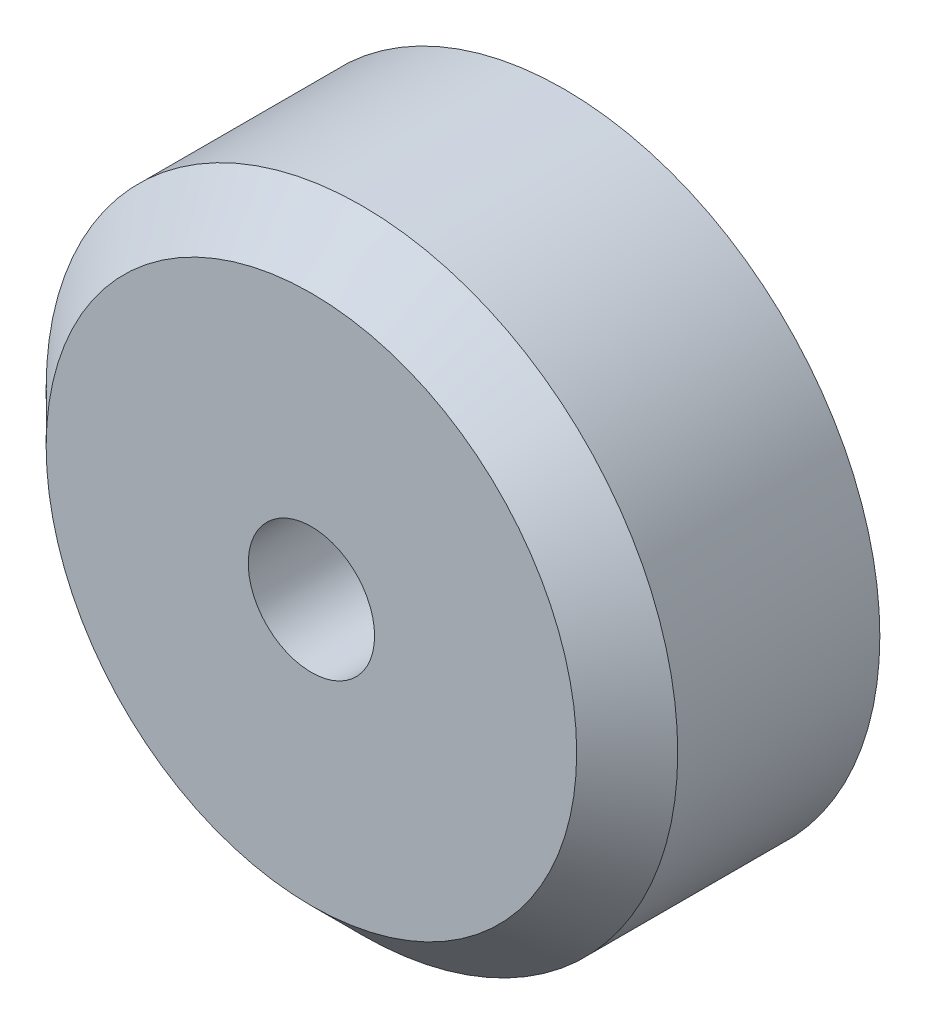
from build123d import *

# Parameters (mm, degrees)
SKETCH1_R           = 1.25
BOSS_EXTRUDE1_DEPTH = 1
SKETCH2_R           = 0.25
CUT_EXTRUDE1_DEPTH  = 3.031009601
CHAMFER1_SIZE       = 0.2


with BuildPart() as part:
    # Sketch1 → Boss-Extrude1 (new body)
    with BuildSketch(Plane.XY):
        Circle(SKETCH1_R)
    extrude(amount=BOSS_EXTRUDE1_DEPTH)

    # Sketch2 → Cut-Extrude1 (cut, through all)
    with BuildSketch(Plane.XY.offset(1)):
        Circle(SKETCH2_R)
    extrude(amount=-CUT_EXTRUDE1_DEPTH, mode=Mode.SUBTRACT)

    # Chamfer1
    chamfer1_edges = [part.edges().sort_by_distance(p)[0] for p in [
        (-1.25, 0, 1),
    ]]
    chamfer(chamfer1_edges, length=CHAMFER1_SIZE)


solid = part.part
